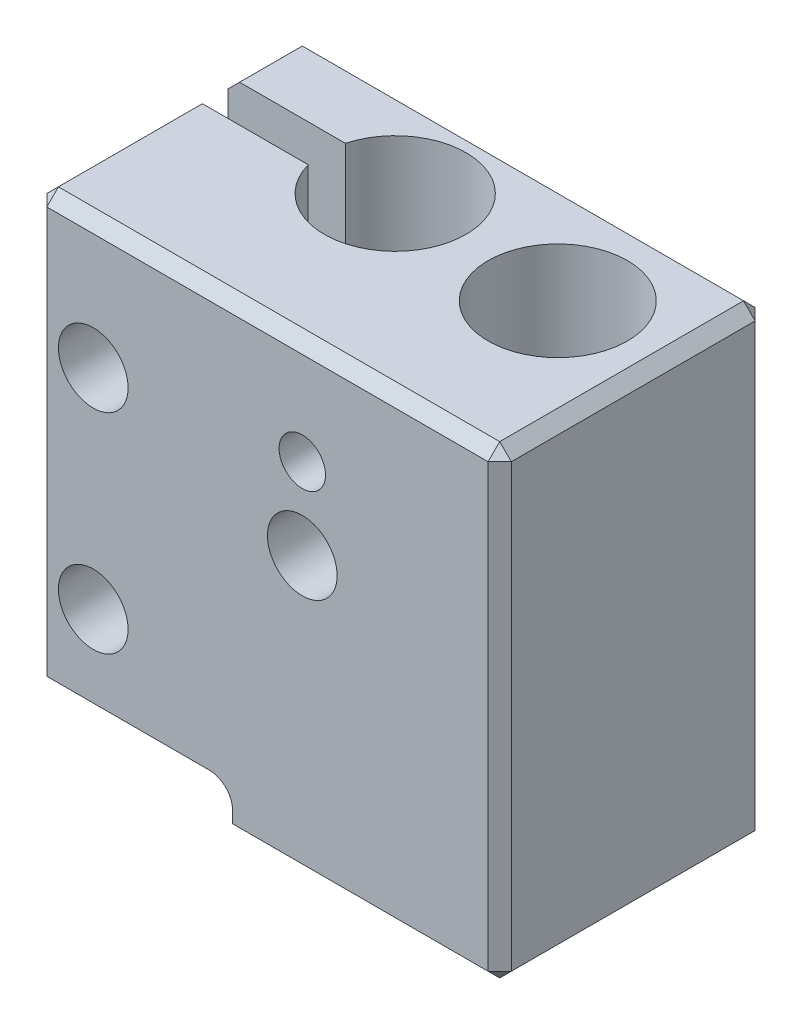
from build123d import *

# Parameters (mm, degrees)
BOSS_EXTRUDE1_DEPTH = 11.5
SKETCH2_R           = 1.5
CUT_EXTRUDE1_DEPTH  = 19.227726134
SKETCH2_3_R         = 0.75
CUT_EXTRUDE2_DEPTH  = 4.5
SKETCH2_4_R         = 1
CUT_EXTRUDE3_DEPTH  = 2
SKETCH2_5_R         = 1.5
CUT_EXTRUDE4_DEPTH  = 3.5
CUT_EXTRUDE5_DEPTH  = 26.144581921
SKETCH3_4_R         = 3
CUT_EXTRUDE6_DEPTH  = 26.144581921
FILLET1_R           = 0.5
CHAMFER1_SIZE       = 0.5


with BuildPart() as part:
    # Sketch1 → Boss-Extrude1 (new body)
    with BuildSketch(Plane.XY):
        Polygon((-10, 10), (10, 10), (10, -10), (-2, -10), (-2, -8.5), (-10, -8.5), align=None)
    extrude(amount=BOSS_EXTRUDE1_DEPTH)

    # Sketch2 → Cut-Extrude1 (cut, through all)
    with BuildSketch(Plane.XY.offset(11.5)):
        with Locations((-7.5, 4.5)):
            Circle(SKETCH2_R)
        with Locations((-7.5, -4.5)):
            Circle(SKETCH2_R)
    extrude(amount=-CUT_EXTRUDE1_DEPTH, mode=Mode.SUBTRACT)

    # Sketch2<3> → Cut-Extrude2 (cut)
    with BuildSketch(Plane.XY.offset(11.5)):
        with Locations((1.5, 5.5)):
            Circle(SKETCH2_3_R)
    extrude(amount=-CUT_EXTRUDE2_DEPTH, mode=Mode.SUBTRACT)

    # Sketch2<4> → Cut-Extrude3 (cut)
    with BuildSketch(Plane.XY.offset(11.5)):
        with Locations((1.5, 5.5)):
            Circle(SKETCH2_4_R)
    extrude(amount=-CUT_EXTRUDE3_DEPTH, mode=Mode.SUBTRACT)

    # Sketch2<5> → Cut-Extrude4 (cut)
    with BuildSketch(Plane.XY.offset(11.5)):
        with Locations((1.5, 2)):
            Circle(SKETCH2_5_R)
    extrude(amount=-CUT_EXTRUDE4_DEPTH, mode=Mode.SUBTRACT)

    # Sketch3 → Cut-Extrude5 (cut, through all)
    with BuildSketch(Plane.XZ.offset(10)):
        with BuildLine():
            Line((-4.943212531, 4.8), (-10, 4.8))
            Line((-10, 4.8), (-10, 3.2))
            Line((-10, 3.2), (-4.943212531, 3.2))
            ThreePointArc((-4.943212531, 3.2), (-5.05, 4), (-4.943212531, 4.8))
        make_face()
        with BuildLine():
            ThreePointArc((-2, 7.05), (-3.852363355, 6.423066239), (-4.943212531, 4.8))
            ThreePointArc((-4.943212531, 4.8), (-5.05, 4), (-4.943212531, 3.2))
            ThreePointArc((-4.943212531, 3.2), (-3.852363355, 1.576933761), (-2, 0.95))
            Line((-2, 0.95), (-2, 7.05))
        make_face()
        with BuildLine():
            ThreePointArc((1.05, 4), (0.156675683, 6.156675683), (-2, 7.05))
            Line((-2, 7.05), (-2, 0.95))
            ThreePointArc((-2, 0.95), (0.156675683, 1.843324317), (1.05, 4))
        make_face()
    extrude(amount=-CUT_EXTRUDE5_DEPTH, mode=Mode.SUBTRACT)

    # Sketch3<4> → Cut-Extrude6 (cut, through all)
    with BuildSketch(Plane.XZ.offset(10)):
        with Locations(Location((5.5, 4.5, 0), (0, 0, 270))):
            Circle(SKETCH3_4_R)
    extrude(amount=-CUT_EXTRUDE6_DEPTH, mode=Mode.SUBTRACT)

    # Fillet1
    fillet1_edges = [part.edges().sort_by_distance(p)[0] for p in [
        (-2, -10, 9.275),
        (-2, -8.5, 9.275),
        (-2, -10, 0.475),
        (-2, -8.5, 0.475),
    ]]
    fillet(fillet1_edges, radius=FILLET1_R)

    # Chamfer1
    chamfer1_edges = [part.edges().sort_by_distance(p)[0] for p in [
        (-10, 0.75, 11.5),
        (10, -10, 5.75),
        (-10, -8.5, 8.15),
        (-10, 10, 8.15),
        (10, 10, 5.75),
        (-6.25, -8.5, 11.5),
        (10, 0, 11.5),
        (-10, -8.5, 1.6),
        (-10, 10, 1.6),
        (-6.25, -8.5, 0),
        (0, 10, 11.5),
        (-10, 0.75, 0),
        (0, 10, 0),
        (-2, -9.25, 0),
        (10, 0, 0),
        (4.25, -10, 0),
        (4.25, -10, 11.5),
        (-2, -9.25, 11.5),
        (-1.853553391, -9.853553391, 11.5),
        (-1.853553391, -9.853553391, 0),
        (-2.146446609, -8.646446609, 0),
        (-2.146446609, -8.646446609, 11.5),
    ]]
    chamfer(chamfer1_edges, length=CHAMFER1_SIZE)


solid = part.part
